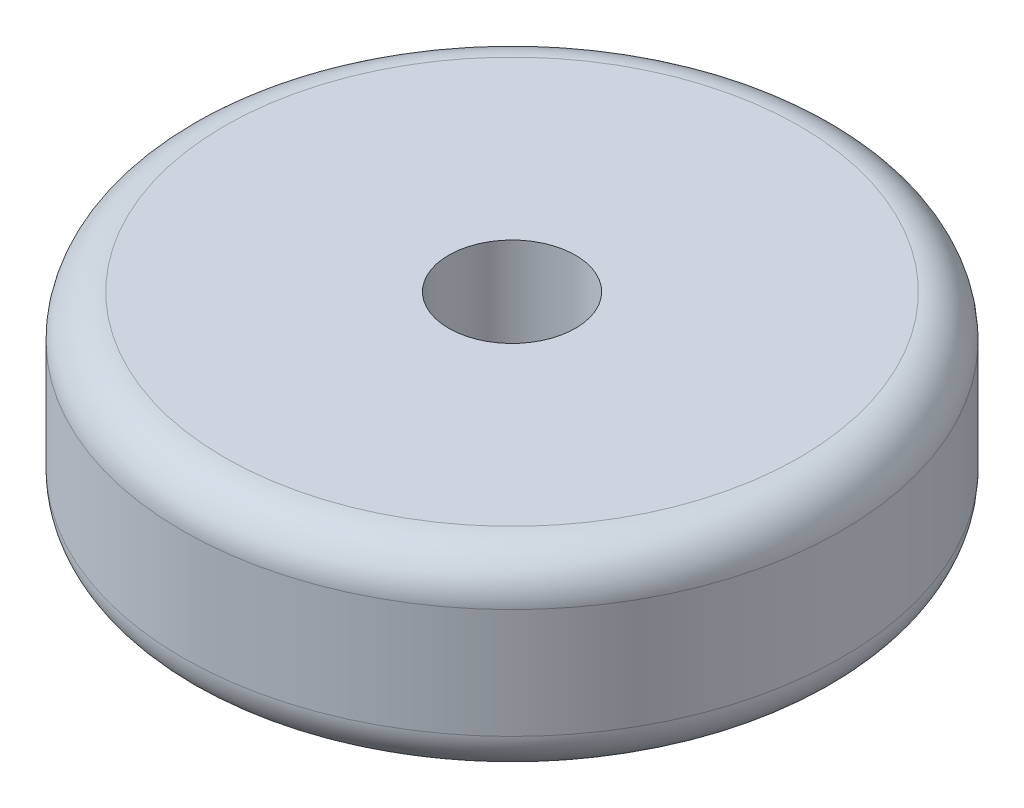
from build123d import *

# Parameters (mm, degrees)
SKETCH1_R               = 39
BOSS_EXTRUDE1_DEPTH     = 11.5
FILLET1_R               = 5
CUT_EXTRUDE1_DEPTH      = 60.757844673
CUT_EXTRUDE1_DEPTH_BACK = 60.757844673
SKETCH2_R               = 7.5


with BuildPart() as part:
    # Sketch1 → Boss-Extrude1 (new, symmetric)
    with BuildSketch(Plane(origin=(0, 0, 0), x_dir=(1, 0, 0), z_dir=(0, 1, 0))):
        with Locations(Location((0, 0, 0), (0, 0, 270))):
            Circle(SKETCH1_R)
    extrude(amount=BOSS_EXTRUDE1_DEPTH, both=True)

    # Fillet1
    fillet1_edges = [part.edges().sort_by_distance(p)[0] for p in [
        (0, -11.5, -39),
        (0, 11.5, -39),
    ]]
    fillet(fillet1_edges, radius=FILLET1_R)

    # Sketch2 → Cut-Extrude1 (cut, two sides: drawn at the far end of the back side and taken through both)
    with BuildSketch(Plane(origin=(0, 11.5, 0), x_dir=(1, 0, 0), z_dir=(0, 1, 0)).offset(-CUT_EXTRUDE1_DEPTH_BACK)):
        with Locations(Location((0, 0, 0), (0, 0, 270))):
            Circle(SKETCH2_R)
    extrude(amount=CUT_EXTRUDE1_DEPTH + CUT_EXTRUDE1_DEPTH_BACK, mode=Mode.SUBTRACT)


solid = part.part
